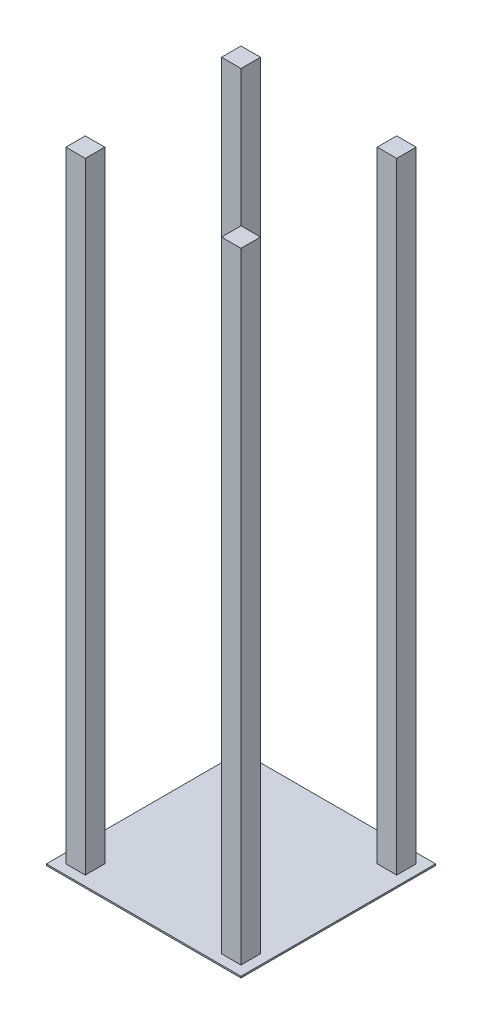
from build123d import *

# Parameters (mm, degrees)
SKETCH1_W           = 254
SKETCH1_H           = 254
BOSS_EXTRUDE1_DEPTH = 2
SKETCH2_W           = 25.4
SKETCH2_H           = 25.4
BOSS_EXTRUDE2_DEPTH = 810


with BuildPart() as part:
    # Sketch1 → Boss-Extrude1 (new body)
    with BuildSketch(Plane(origin=(0, 0, 0), x_dir=(1, 0, 0), z_dir=(0, 1, 0))):
        Rectangle(SKETCH1_W, SKETCH1_H)
    extrude(amount=BOSS_EXTRUDE1_DEPTH)

    # Sketch2 → Boss-Extrude2 (add)
    with BuildSketch(Plane(origin=(0, 2, 0), x_dir=(1, 0, 0), z_dir=(0, 1, 0))):
        with Locations((-101.6, 101.6)):
            Rectangle(SKETCH2_W, SKETCH2_H)
        with Locations((-101.6, -101.6)):
            Rectangle(SKETCH2_W, SKETCH2_H)
        with Locations((101.6, -101.6)):
            Rectangle(SKETCH2_W, SKETCH2_H)
        with Locations((101.6, 101.6)):
            Rectangle(SKETCH2_W, SKETCH2_H)
    extrude(amount=BOSS_EXTRUDE2_DEPTH)


solid = part.part
